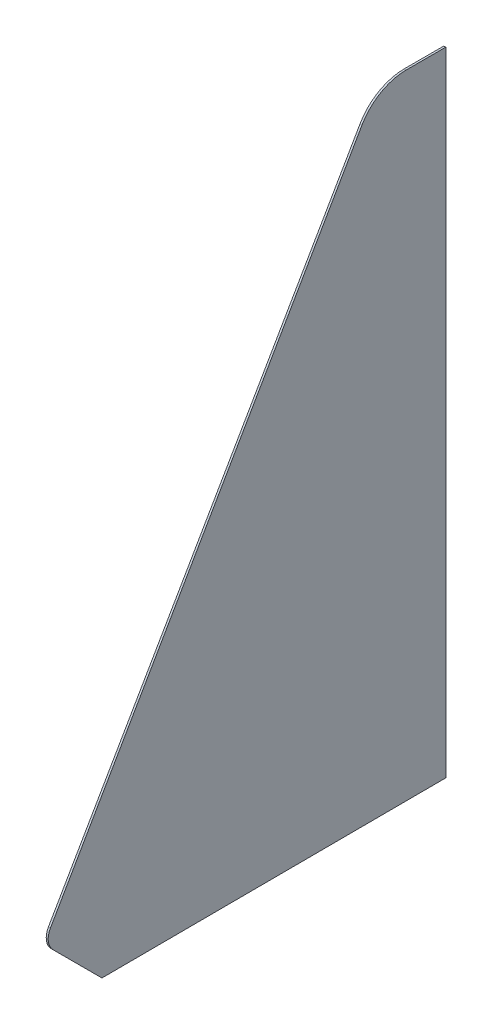
from build123d import *

# Parameters (mm, degrees)
THICKEN1_T1 = 2


with BuildPart() as body_1:
    # Sketch1 → Surface-Plane1: a flat surface bounded by the sketch
    with BuildSketch(Plane(origin=(0, 0, 0), x_dir=(0, 0, -1), z_dir=(1, 0, 0)), mode=Mode.PRIVATE) as surface_plane1_1_region:
        with BuildLine():
            Line((0, 642), (-40, 642))
            ThreePointArc((-40, 642), (-66, 635.033320997), (-85.033320997, 616))
            Line((-85.033320997, 616), (-401.033320997, 68.671944808))
            ThreePointArc((-401.033320997, 68.671944808), (-403.165451776, 57.95299954), (-398.331704413, 48.151129528))
            Line((-398.331704413, 48.151129528), (-348.766361322, -1.414213562))
            Line((-348.766361322, -1.414213562), (0, 0))
            Line((0, 0), (0, 642))
        make_face()
    surface_plane1_1 = surface_plane1_1_region.sketch.faces()[0]
    add(Solid.thicken(surface_plane1_1, THICKEN1_T1))


solid = body_1.part
